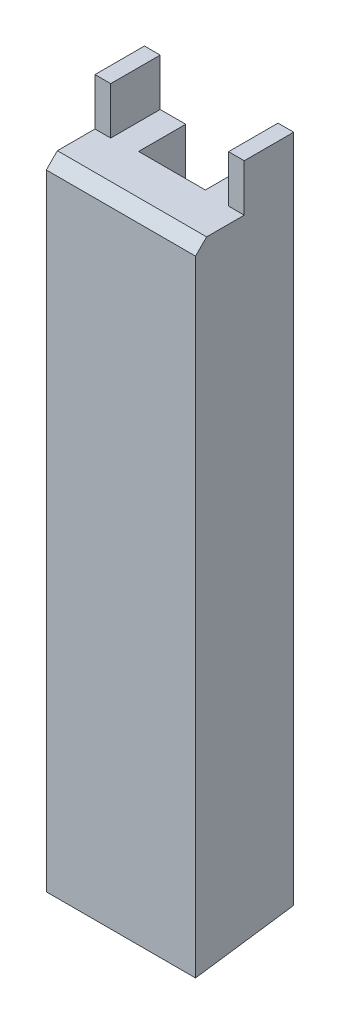
from build123d import *

# Parameters (mm, degrees)
SKETCH1_W           = 19
SKETCH1_H           = 81
BOSS_EXTRUDE1_DEPTH = 12.5
SKETCH2_W           = 8.5
SKETCH2_H           = 81
CUT_EXTRUDE1_DEPTH  = 6
SKETCH3_W           = 31.784398885
SKETCH3_H           = 20.084620154
CUT_EXTRUDE2_DEPTH  = 82.482700732
SKETCH4_W           = 27.793270948
SKETCH4_H           = 17.497219338
CUT_EXTRUDE3_DEPTH  = 82.444960882
SKETCH5_W           = 2
SKETCH5_H           = 6.3
BOSS_EXTRUDE2_DEPTH = 6


with BuildPart() as part:
    # Sketch1 → Boss-Extrude1 (new body)
    with BuildSketch(Plane.XY):
        with Locations((-0.214285714, -27.308823529)):
            Rectangle(SKETCH1_W, SKETCH1_H)
    extrude(amount=BOSS_EXTRUDE1_DEPTH)

    # Sketch2 → Cut-Extrude1 (cut)
    with BuildSketch(Plane(origin=(0, 0, 0), x_dir=(-1, 0, 0), z_dir=(0, 0, -1))):
        with Locations((0.214285714, -27.308823529)):
            Rectangle(SKETCH2_W, SKETCH2_H)
    extrude(amount=-CUT_EXTRUDE1_DEPTH, mode=Mode.SUBTRACT)

    # Sketch3 → Cut-Extrude2 (cut, through all)
    with BuildSketch(Plane(origin=(0, -64.772690644, -9.103208009), x_dir=(1, 0, 0), z_dir=(0, -0.9902680687415703, -0.13917310096006574))):
        with Locations((-0.737280551, 17.487835558)):
            Rectangle(SKETCH3_W, SKETCH3_H)
    extrude(amount=CUT_EXTRUDE2_DEPTH, mode=Mode.SUBTRACT)

    # Sketch4 → Cut-Extrude3 (cut, through all)
    with BuildSketch(Plane(origin=(0, 12.138481454, 12.138481454), x_dir=(-1, 0, 0), z_dir=(0, 0.7071067811865464, 0.7071067811865488))):
        with Locations((0.087709147, -6.370587608)):
            Rectangle(SKETCH4_W, SKETCH4_H)
    extrude(amount=CUT_EXTRUDE3_DEPTH, mode=Mode.SUBTRACT)

    # Sketch5 → Boss-Extrude2 (add)
    with BuildSketch(Plane(origin=(0, 13.191176471, 0), x_dir=(1, 0, 0), z_dir=(0, 1, 0))):
        with Locations((-8.714285714, -3.15)):
            Rectangle(SKETCH5_W, SKETCH5_H)
        with Locations((8.285714286, -3.15)):
            Rectangle(SKETCH5_W, SKETCH5_H)
    extrude(amount=BOSS_EXTRUDE2_DEPTH)


solid = part.part
